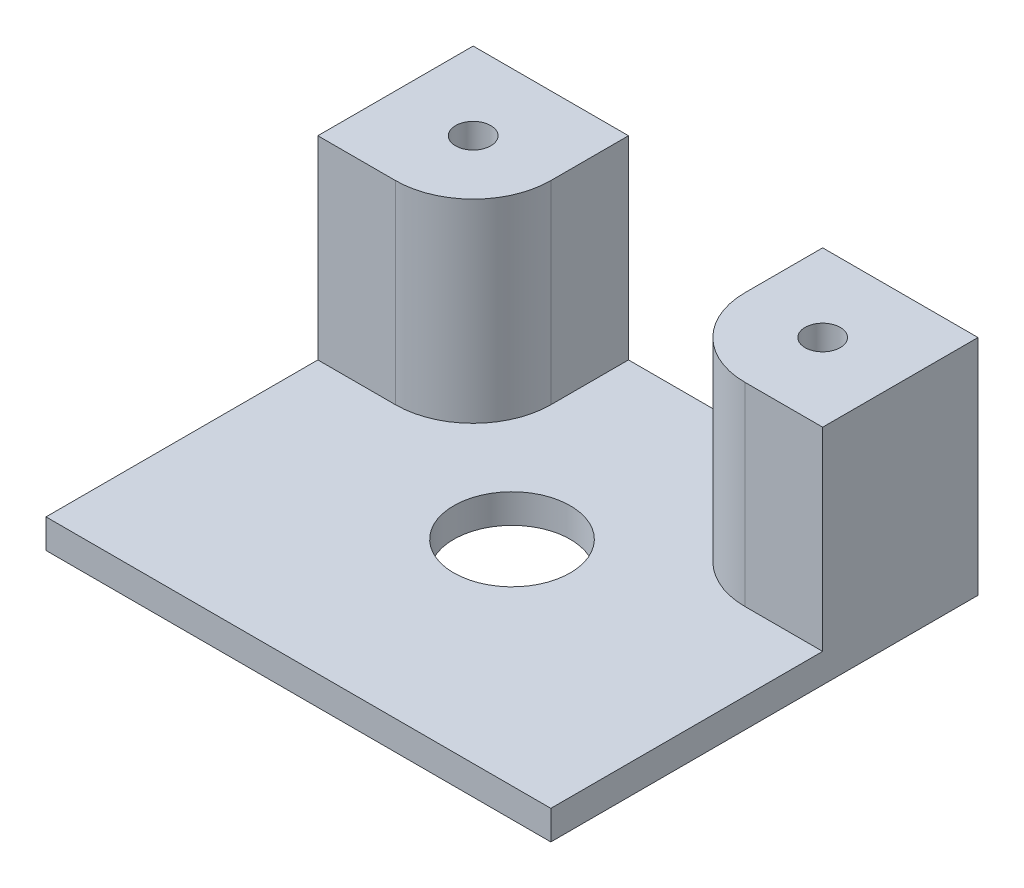
from build123d import *

# Parameters (mm, degrees)
SKETCH1_W            = 165.1
SKETCH1_H            = 139.7
BOSS_EXTRUDE1_DEPTH  = 9.525
SKETCH2_W            = 50.8
SKETCH2_H            = 50.8
BOSS_EXTRUDE2_DEPTH  = 63.5
FILLET1_R            = 25.4
FILLET1_OF_MIRROR1_R = 25.4
SKETCH5_R            = 19.05
BASE_HOLE_DEPTH      = 126.402452129


with BuildPart() as part:
    # Sketch1 → Boss-Extrude1 (new body)
    with BuildSketch(Plane(origin=(0, 0, 0), x_dir=(1, 0, 0), z_dir=(0, 1, 0))):
        Rectangle(SKETCH1_W, SKETCH1_H)
    extrude(amount=BOSS_EXTRUDE1_DEPTH)

    # Sketch2 → Boss-Extrude2 (add)
    with BuildSketch(Plane(origin=(0, 9.525, 0), x_dir=(1, 0, 0), z_dir=(0, 1, 0))):
        with Locations((-57.15, 44.45)):
            Rectangle(SKETCH2_W, SKETCH2_H)
    boss_extrude2 = extrude(amount=BOSS_EXTRUDE2_DEPTH)

    # Sketch3 → 1/2-20 Tapped Hole1 (revolve, cut)
    with BuildSketch(Plane(origin=(-57.15, 73.025, -44.45), x_dir=(0, 0, 1), z_dir=(1, 0, 0))):
        Polygon((0, 0), (0, 35.20757432), (5.75437, 31.75), (5.75437, 0), align=None)
    f_1_2_20_tapped_hole1 = revolve(axis=Axis((-57.15, 79.375, -44.45), (0, -1, 0)), mode=Mode.SUBTRACT)

    # Fillet1
    fillet1_edges = [part.edges().sort_by_distance(p)[0] for p in [
        (-31.75, 41.275, -19.05),
    ]]
    fillet(fillet1_edges, radius=FILLET1_R)

    # Mirror1: Boss-Extrude2, 1/2-20 Tapped Hole1 across plane
    add(boss_extrude2.mirror(Plane(origin=(0, 0, 0), x_dir=(0, 0, 1), z_dir=(1, 0, 0))))
    add(f_1_2_20_tapped_hole1.mirror(Plane(origin=(0, 0, 0), x_dir=(0, 0, 1), z_dir=(1, 0, 0))), mode=Mode.SUBTRACT)

    # Fillet1 of Mirror1
    fillet1_of_mirror1_edges = [part.edges().sort_by_distance(p)[0] for p in [
        (31.75, 41.275, -19.05),
    ]]
    fillet(fillet1_of_mirror1_edges, radius=FILLET1_OF_MIRROR1_R)

    # Sketch5 → base hole (cut, through all)
    with BuildSketch(Plane(origin=(0, 9.525, 0), x_dir=(1, 0, 0), z_dir=(0, 1, 0))):
        with Locations(Location((0, 0, 0), (0, 0, 270))):
            Circle(SKETCH5_R)
    extrude(amount=-BASE_HOLE_DEPTH, mode=Mode.SUBTRACT)


solid = part.part
